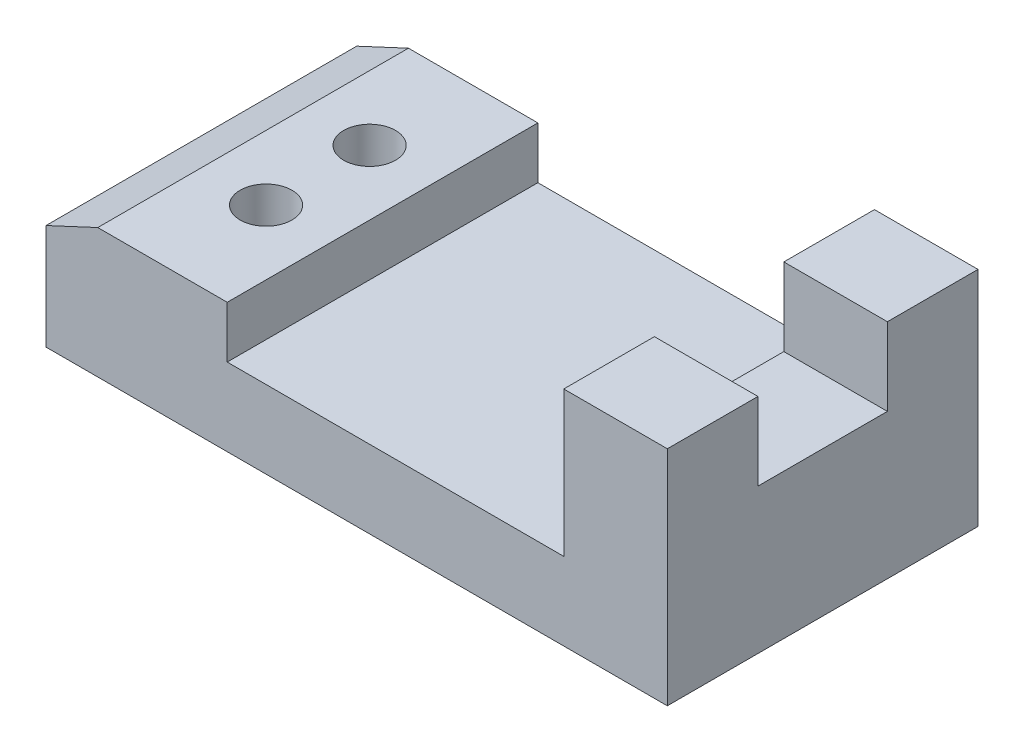
from build123d import *

# Parameters (mm, degrees)
BOSS_EXTRUDE1_DEPTH     = 60
SKETCH2_W               = 20
SKETCH2_H               = 25
CUT_EXTRUDE1_DEPTH      = 15
CUT_EXTRUDE2_DEPTH      = 137.47344064
CUT_EXTRUDE2_DEPTH_BACK = 137.47344064
SKETCH3_R               = 5


with BuildPart() as part:
    # Sketch1 → Boss-Extrude1 (new body)
    with BuildSketch(Plane.XY):
        Polygon((0, 0), (120, 0), (120, 43), (100, 43), (100, 15), (35, 15), (35, 25), (10, 25), (0, 20.336923418), align=None)
    extrude(amount=BOSS_EXTRUDE1_DEPTH)

    # Sketch2 → Cut-Extrude1 (cut)
    with BuildSketch(Plane(origin=(0, 43, 0), x_dir=(1, 0, 0), z_dir=(0, 1, 0))):
        with Locations((110, -30)):
            Rectangle(SKETCH2_W, SKETCH2_H)
    extrude(amount=-CUT_EXTRUDE1_DEPTH, mode=Mode.SUBTRACT)

    # Sketch3 → Cut-Extrude2 (cut, two sides: drawn at the far end of the back side and taken through both)
    with BuildSketch(Plane(origin=(0, 25, 0), x_dir=(1, 0, 0), z_dir=(0, 1, 0)).offset(-CUT_EXTRUDE2_DEPTH_BACK)):
        with Locations(Location((22.5, -40, 0), (0, 0, 180))):
            Circle(SKETCH3_R)
        with Locations(Location((22.5, -20, 0), (0, 0, 180))):
            Circle(SKETCH3_R)
    extrude(amount=CUT_EXTRUDE2_DEPTH + CUT_EXTRUDE2_DEPTH_BACK, mode=Mode.SUBTRACT)


solid = part.part
